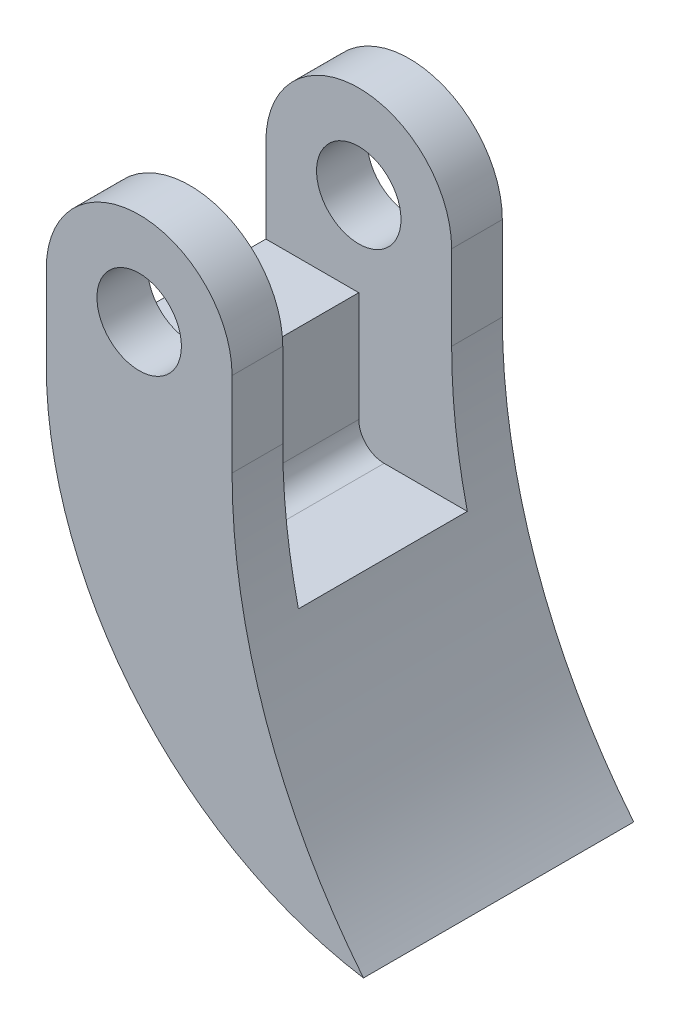
from build123d import *

# Parameters (mm, degrees)
EXTRUDE_1_DEPTH     = 16
SKETCH_2_R          = 2.5
CUT_EXTRUDE_1_DEPTH = 76.727440999
SKETCH_3_W          = 10
SKETCH_3_H          = 10.5
CUT_EXTRUDE_2_DEPTH = 16
SKETCH_4_W          = 7
SKETCH_4_H          = 10
CUT_EXTRUDE_3_DEPTH = 8
FILLET_1_R          = 1.5


with BuildPart() as part:
    # 草图1 → 凸台-拉伸1 (new body)
    with BuildSketch(Plane.XY):
        with BuildLine():
            Line((-4.161479336, 67.0602), (-4.161479336, 62.0602))
            ThreePointArc((-4.161479336, 62.0602), (1.171570518, 47.59784366), (14.617205486, 40.0602))
            ThreePointArc((14.617205486, 40.0602), (8.840444726, 50.39285307), (6.838520664, 62.0602))
            Line((6.838520664, 62.0602), (6.838520664, 67.0602))
            ThreePointArc((6.838520664, 67.0602), (1.338520664, 72.5602), (-4.161479336, 67.0602))
        make_face()
    extrude(amount=EXTRUDE_1_DEPTH)

    # 草图2 → 切除-拉伸1 (cut, through all)
    with BuildSketch(Plane.XY.offset(16)):
        with Locations((1.338520664, 67.0602)):
            Circle(SKETCH_2_R)
    extrude(amount=-CUT_EXTRUDE_1_DEPTH, mode=Mode.SUBTRACT)

    # 草图3 → 切除-拉伸2 (cut)
    with BuildSketch(Plane(origin=(6.838520664, 0, 0), x_dir=(0, 0, -1), z_dir=(1, 0, 0))):
        with Locations((-8, 67.3102)):
            Rectangle(SKETCH_3_W, SKETCH_3_H)
    extrude(amount=-CUT_EXTRUDE_2_DEPTH, mode=Mode.SUBTRACT)

    # 草图4 → 切除-拉伸3 (cut)
    with BuildSketch(Plane(origin=(0, 62.0602, 0), x_dir=(1, 0, 0), z_dir=(0, 1, 0))):
        with Locations((4.838520664, -8)):
            Rectangle(SKETCH_4_W, SKETCH_4_H)
    extrude(amount=-CUT_EXTRUDE_3_DEPTH, mode=Mode.SUBTRACT)

    # 圆角1
    fillet_1_edges = [part.edges().sort_by_distance(p)[0] for p in [
        (1.338520664, 54.0602, 8),
    ]]
    fillet(fillet_1_edges, radius=FILLET_1_R)


solid = part.part
